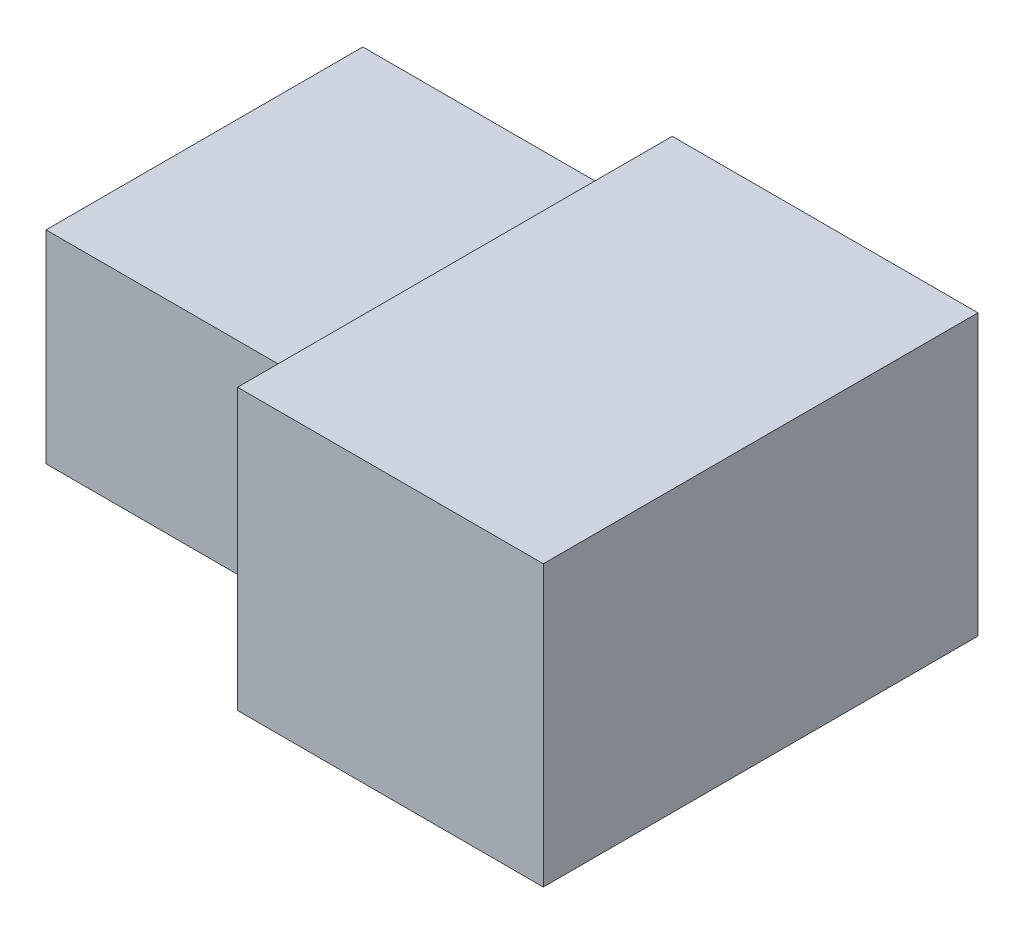
from build123d import *

# Parameters (mm, degrees)
BOSS_EXTRUDE1_DEPTH = 76
SKETCH1_3_W         = 84
SKETCH1_3_H         = 86
BOSS_EXTRUDE2_DEPTH = 55


with BuildPart() as part:
    # Sketch1 → Boss-Extrude1 (new body)
    with BuildSketch(Plane(origin=(0, 0, 0), x_dir=(1, 0, 0), z_dir=(0, 1, 0))):
        Polygon((83, 0), (0, 0), (0, -86), (0, -118), (83, -118), align=None)
    extrude(amount=BOSS_EXTRUDE1_DEPTH)

    # Sketch1<3> → Boss-Extrude2 (add)
    with BuildSketch(Plane(origin=(0, 0, 0), x_dir=(1, 0, 0), z_dir=(0, 1, 0))):
        with Locations((-42, -43)):
            Rectangle(SKETCH1_3_W, SKETCH1_3_H)
    extrude(amount=BOSS_EXTRUDE2_DEPTH)


solid = part.part
